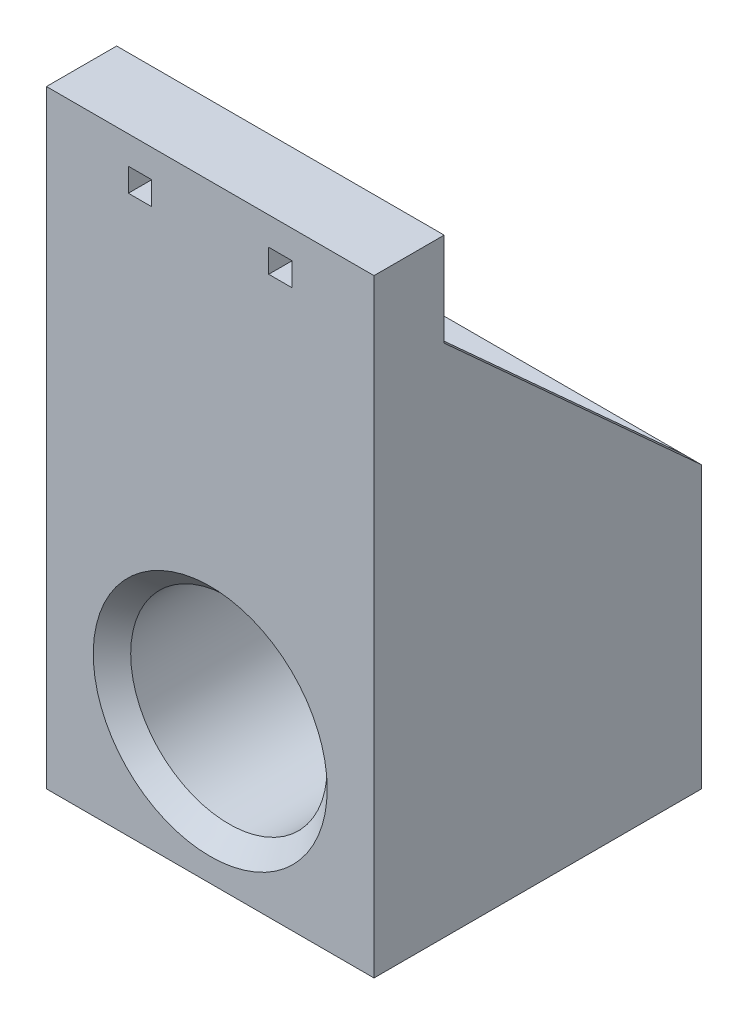
from build123d import *

# Parameters (mm, degrees)
SKETCH1_W           = 5
SKETCH1_H           = 70
SKETCH1_W_2         = 70
SKETCH1_H_2         = 60
BOSS_EXTRUDE1_DEPTH = 35
SKETCH2_R           = 21
CUT_EXTRUDE1_DEPTH  = 127.984250992
CHAMFER1_SIZE       = 4
CHAMFER2_SIZE       = 4
SKETCH9_W           = 10
SKETCH9_H           = 20
BOSS_EXTRUDE2_DEPTH = 70
RIB1_REACH          = 128.984
SKETCH10_WALL_W     = 330.29884572
SKETCH10_WALL_H     = 4
SKETCH11_W          = 5
SKETCH11_H          = 5
CUT_EXTRUDE2_DEPTH  = 10


with BuildPart() as part:
    # Sketch1 → Boss-Extrude1 (new, symmetric)
    with BuildSketch(Plane(origin=(0, 0, 0), x_dir=(0, 0, -1), z_dir=(1, 0, 0))):
        with Locations((-32.5, 65)):
            Rectangle(SKETCH1_W, SKETCH1_H)
        Rectangle(SKETCH1_W_2, SKETCH1_H_2)
    extrude(amount=BOSS_EXTRUDE1_DEPTH, both=True)

    # Sketch2 → Cut-Extrude1 (cut, through all)
    with BuildSketch(Plane(origin=(0, 0, -35), x_dir=(-1, 0, 0), z_dir=(0, 0, -1))):
        Circle(SKETCH2_R)
    extrude(amount=-CUT_EXTRUDE1_DEPTH, mode=Mode.SUBTRACT)

    # Chamfer1
    chamfer1_edges = [part.edges().sort_by_distance(p)[0] for p in [
        (21, 0, 35),
    ]]
    chamfer(chamfer1_edges, length=CHAMFER1_SIZE)

    # Chamfer2
    chamfer2_edges = [part.edges().sort_by_distance(p)[0] for p in [
        (21, 0, -35),
    ]]
    chamfer(chamfer2_edges, length=CHAMFER2_SIZE)

    # Sketch9 → Boss-Extrude2 (add, through all)
    with BuildSketch(Plane(origin=(35, 0, 0), x_dir=(0, 0, -1), z_dir=(1, 0, 0))):
        with Locations((-25, 90)):
            Rectangle(SKETCH9_W, SKETCH9_H)
    extrude(amount=-BOSS_EXTRUDE2_DEPTH)

    # Sketch10 wall → Rib1 (add, up to next)
    with BuildSketch(Plane(origin=(35, 55, -7.5), x_dir=(0, -0.672672793996, -0.739940073396), z_dir=(0, 0.739940073396, -0.672672793996)), mode=Mode.PRIVATE) as rib1_sk1:
        with Locations((0, 2)):
            Rectangle(SKETCH10_WALL_W, SKETCH10_WALL_H)
    rib1_tool1 = extrude(rib1_sk1.sketch, amount=-RIB1_REACH, mode=Mode.PRIVATE) - part.part
    rib1 = rib1_tool1.solids().sort_by_distance((35, 55, -7.5))[0]
    add(rib1)

    # Mirror1: Rib1 across plane
    add(rib1.mirror(Plane(origin=(0, 0, 0), x_dir=(0, 0, 1), z_dir=(1, 0, 0))))

    # Sketch11 → Cut-Extrude2 (cut)
    with BuildSketch(Plane.XY.offset(35)):
        with Locations((15, 91.5)):
            Rectangle(SKETCH11_W, SKETCH11_H)
        with Locations((-15, 91.5)):
            Rectangle(SKETCH11_W, SKETCH11_H)
    extrude(amount=-CUT_EXTRUDE2_DEPTH, mode=Mode.SUBTRACT)


solid = part.part
